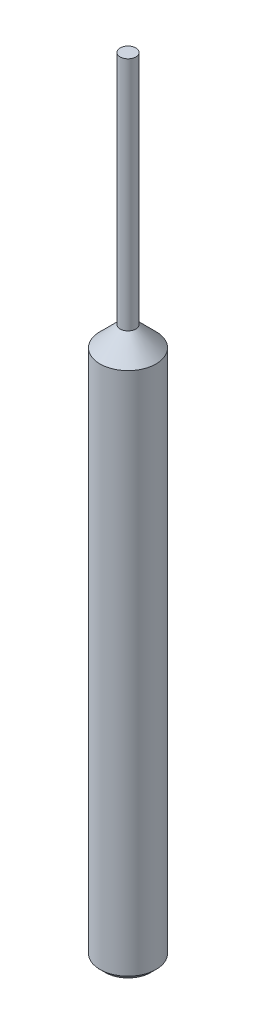
from build123d import *


with BuildPart() as part:
    # Skizze2 → Rotation1 (revolve)
    with BuildSketch(Plane.XY, mode=Mode.PRIVATE) as rotation1_sk:
        Polygon((0, 0), (4.35, 0), (5.35, 1), (5.35, 101.15), (1.5, 105), (1.5, 150), (0, 150), align=None)
    revolve(rotation1_sk.sketch.rotate(Axis((0, -34.793730628, 0), (0, 1, 0)), 90), axis=Axis((0, -34.793730628, 0), (0, 1, 0)))


solid = part.part
